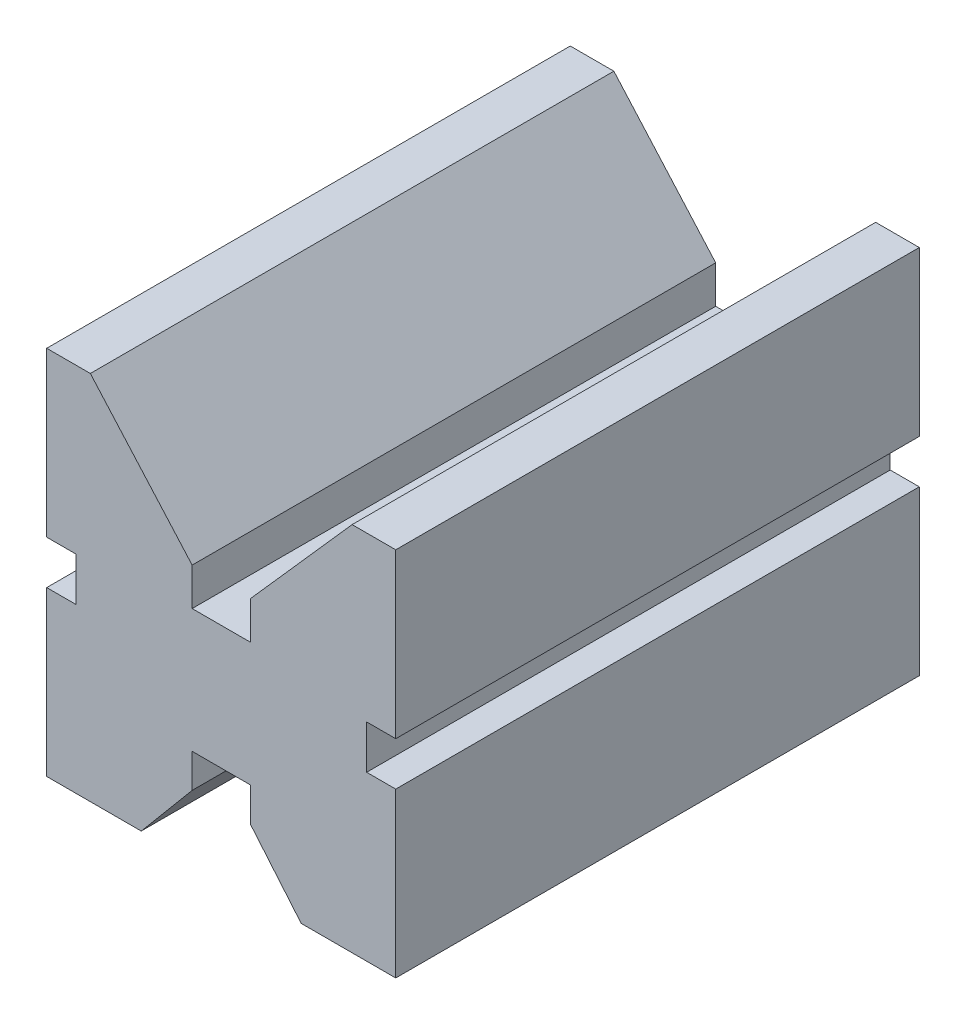
from build123d import *

# Parameters (mm, degrees)
BOSS_EXTRUDE1_DEPTH = 36
CUT_EXTRUDE1_DEPTH  = 81.06403687


with BuildPart() as part:
    # Sketch1 → Boss-Extrude1 (new, symmetric)
    with BuildSketch(Plane.XY):
        Polygon((-24, 25.5), (-4, 25.5), (-4, 4.5), (4, 4.5), (4, 25.5), (24, 25.5), (24, 3), (20, 3), (20, -3), (24, -3), (24, -25.5), (4, -25.5), (4, -12.5), (-4, -12.5), (-4, -25.5), (-24, -25.5), (-24, -3), (-20, -3), (-20, 3), (-24, 3), align=None)
    extrude(amount=BOSS_EXTRUDE1_DEPTH, both=True)

    # Sketch3 → Cut-Extrude1 (cut, through all)
    with BuildSketch(Plane.XY.offset(36)):
        Polygon((-4, 9.675878591), (-18, 25.5), (-4, 25.5), align=None)
        Polygon((4, 9.675878591), (18, 25.5), (4, 25.5), align=None)
        Polygon((4, -17.157724852), (11, -25.5), (4, -25.5), align=None)
        Polygon((-4, -17.157724852), (-11, -25.5), (-4, -25.5), align=None)
    extrude(amount=-CUT_EXTRUDE1_DEPTH, mode=Mode.SUBTRACT)


solid = part.part
